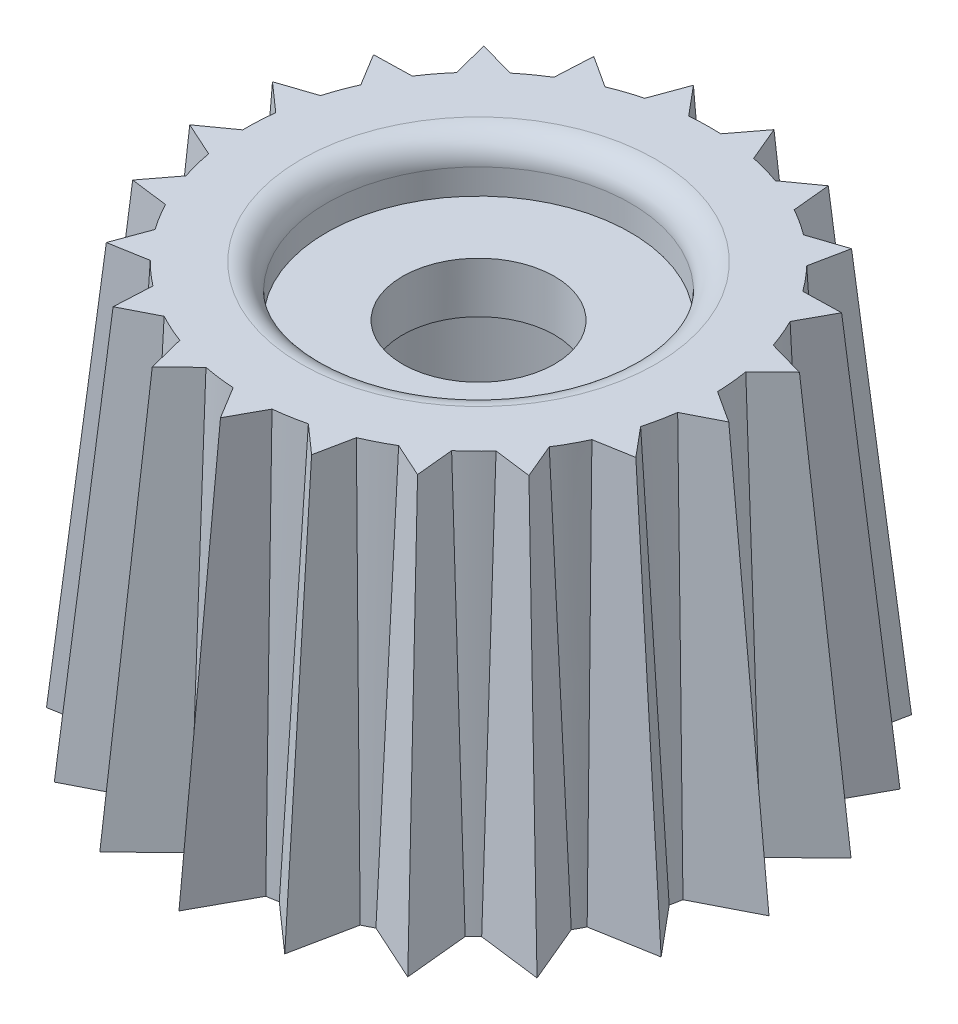
from build123d import *

# Parameters (mm, degrees)
BOSS_EXTRUDE1_DEPTH = 8
BOSS_EXTRUDE1_DRAFT = 3
SKETCH2_R           = 3
CUT_EXTRUDE1_DEPTH  = 6
SKETCH3_R           = 1.5
CUT_EXTRUDE2_DEPTH  = 6
FILLET3_R           = 0.5
CUT_EXTRUDE3_START  = -1
SKETCH4_R           = 3
CUT_EXTRUDE3_DEPTH  = 1
FILLET4_R           = 0.5


with BuildPart() as part:
    # Sketch1 → Boss-Extrude1 (with draft: the straight prism first)
    with BuildSketch(Plane(origin=(0, 0, 0), x_dir=(1, 0, 0), z_dir=(0, 1, 0))):
        with BuildLine():
            ThreePointArc((0, 5), (-0.115399429, 4.99866812), (-0.230737379, 4.994673189))
            Line((-0.230737379, 4.994673189), (-1.040018866, 5.962771522))
            Line((-1.040018866, 5.962771522), (-1.473775872, 4.777864029))
            ThreePointArc((-1.473775872, 4.777864029), (-1.58365585, 4.742576742), (-1.692692132, 4.704762837))
            Line((-1.692692132, 4.704762837), (-2.751371505, 5.391311371))
            Line((-2.751371505, 5.391311371), (-2.81660029, 4.131193872))
            ThreePointArc((-2.81660029, 4.131193872), (-2.911197498, 4.065086607), (-3.00424376, 3.99681366))
            Line((-3.00424376, 3.99681366), (-4.218252713, 4.340809546))
            Line((-4.218252713, 4.340809546), (-3.909157412, 3.117449009))
            ThreePointArc((-3.909157412, 3.117449009), (-3.980066474, 3.026395689), (-4.048855146, 2.93373005))
            Line((-4.048855146, 2.93373005), (-5.310323655, 2.904607743))
            Line((-5.310323655, 2.904607743), (-4.654368743, 1.826705122))
            ThreePointArc((-4.654368743, 1.826705122), (-4.695289077, 1.718796232), (-4.733707985, 1.60997165))
            Line((-4.733707985, 1.60997165), (-5.930549036, 1.210318796))
            Line((-5.930549036, 1.210318796), (-4.986018986, 0.373650468))
            ThreePointArc((-4.986018986, 0.373650468), (-4.99331464, 0.258474187), (-4.997950095, 0.143160204))
            Line((-4.997950095, 0.143160204), (-6.02381911, -0.591512288))
            Line((-6.02381911, -0.591512288), (-4.874639561, -1.11260467))
            ThreePointArc((-4.874639561, -1.11260467), (-4.847662285, -1.224814423), (-4.818102407, -1.336371654))
            Line((-4.818102407, -1.336371654), (-5.581846421, -2.340784909))
            Line((-5.581846421, -2.340784909), (-4.330127019, -2.5))
            ThreePointArc((-4.330127019, -2.5), (-4.271273862, -2.599272897), (-4.210145176, -2.697161026))
            Line((-4.210145176, -2.697161026), (-4.643902182, -3.882068519))
            Line((-4.643902182, -3.882068519), (-3.400863689, -3.665259359))
            ThreePointArc((-3.400863689, -3.665259359), (-3.315364013, -3.742774568), (-3.228098069, -3.818295805))
            Line((-3.228098069, -3.818295805), (-3.293326854, -5.078413304))
            Line((-3.293326854, -5.078413304), (-2.169418696, -4.50484434))
            ThreePointArc((-2.169418696, -4.50484434), (-2.064869521, -4.553714293), (-1.959220284, -4.600158245))
            Line((-1.959220284, -4.600158245), (-1.650124983, -5.823518782))
            Line((-1.650124983, -5.823518782), (-0.745211331, -4.944154131))
            ThreePointArc((-0.745211331, -4.944154131), (-0.630902312, -4.960036519), (-0.516257178, -4.973276438))
            Line((-0.516257178, -4.973276438), (0.139697734, -6.051179059))
            Line((0.139697734, -6.051179059), (0.745211331, -4.944154131))
            ThreePointArc((0.745211331, -4.944154131), (0.859123337, -4.925637734), (0.972577644, -4.904497194))
            Line((0.972577644, -4.904497194), (1.917107695, -5.741165522))
            Line((1.917107695, -5.741165522), (2.169418696, -4.50484434))
            ThreePointArc((2.169418696, -4.50484434), (2.272812107, -4.453574421), (2.374994674, -4.399931852))
            Line((2.374994674, -4.399931852), (3.524174223, -4.921024233))
            Line((3.524174223, -4.921024233), (3.400863689, -3.665259359))
            ThreePointArc((3.400863689, -3.665259359), (3.484551548, -3.585791476), (3.566383005, -3.504413255))
            Line((3.566383005, -3.504413255), (4.818102407, -3.663628346))
            Line((4.818102407, -3.663628346), (4.330127019, -2.5))
            ThreePointArc((4.330127019, -2.5), (4.386673291, -2.399395223), (4.440882555, -2.297512163))
            Line((4.440882555, -2.297512163), (5.683921048, -2.080703003))
            Line((5.683921048, -2.080703003), (4.874639561, -1.11260467))
            ThreePointArc((4.874639561, -1.11260467), (4.899019862, -0.999802174), (4.920790201, -0.886467032))
            Line((4.920790201, -0.886467032), (6.04469836, -0.312898067))
            Line((6.04469836, -0.312898067), (4.986018986, 0.373650468))
            ThreePointArc((4.986018986, 0.373650468), (4.97606702, 0.488627685), (4.963464044, 0.603344585))
            Line((4.963464044, 0.603344585), (5.868377696, 1.482709236))
            Line((5.868377696, 1.482709236), (4.654368743, 1.826705122))
            ThreePointArc((4.654368743, 1.826705122), (4.610968785, 1.933640831), (4.565112324, 2.039546388))
            Line((4.565112324, 2.039546388), (5.170625921, 3.146571316))
            Line((5.170625921, 3.146571316), (3.909157412, 3.117449009))
            ThreePointArc((3.909157412, 3.117449009), (3.836165739, 3.206841502), (3.761130341, 3.294525544))
            Line((3.761130341, 3.294525544), (4.013441342, 4.530846726))
            Line((4.013441342, 4.530846726), (2.81660029, 4.131193872))
            ThreePointArc((2.81660029, 4.131193872), (2.720502533, 4.195100234), (2.622955421, 4.256771647))
            Line((2.622955421, 4.256771647), (2.499644887, 5.512536521))
            Line((2.499644887, 5.512536521), (1.473775872, 4.777864029))
            ThreePointArc((1.473775872, 4.777864029), (1.363110737, 4.810605899), (1.251719402, 4.840784909))
            Line((1.251719402, 4.840784909), (0.763744014, 6.004413255))
            Line((0.763744014, 6.004413255), (0, 5))
        make_face()
    extrude(amount=BOSS_EXTRUDE1_DEPTH)
    # Boss-Extrude1: the draft: its side faces are tilted about the plane it starts from
    boss_extrude1_sides = [part.faces().sort_by_distance(p)[0] for p in [
        (4.867869122, 4, -2.593058852),
        (4.539891667, 4, -3.132010163),
        (3.836165739, 4, -3.206841502),
        (3.887285841, 4, -3.912686135),
        (3.415020816, 4, -4.331020299),
        (2.720502533, 4, -4.195100234),
        (2.561300154, 4, -4.884654084),
        (1.98671038, 4, -5.145200275),
        (1.363110737, 4, -4.810605899),
        (1.007731708, 4, -5.422599082),
        (0.381872007, 4, -5.502206628),
        (-0.115399429, 4, -4.99866812),
        (-0.635378122, 4, -5.478722355),
        (-1.256897369, 4, -5.370317775),
        (-1.58365585, 4, -4.742576742),
        (-2.222031818, 4, -5.048037104),
        (-2.783985898, 4, -4.761252621),
        (-2.911197498, 4, -4.065086607),
        (-3.611248236, 4, -4.168811603),
        (-4.063705062, 4, -3.729129278),
        (-3.980066474, 4, -3.026395689),
        (-4.679589401, 4, -2.919168896),
        (-4.982346199, 4, -2.365656432),
        (-4.695289077, 4, -1.718796232),
        (-5.332128511, 4, -1.410145223),
        (-5.458284011, 4, -0.791984632),
        (-4.99331464, 4, -0.258474187),
        (-5.510884603, 4, 0.224176042),
        (-5.449229336, 4, 0.852058479),
        (-4.847662285, 4, 1.224814423),
        (-5.199974414, 4, 1.838578282),
        (-4.95598672, 4, 2.420392455),
        (-4.271273862, 4, 2.599272897),
        (-4.427023679, 4, 3.289614773),
        (-4.022382935, 4, 3.773663939),
        (-3.315364013, 4, 3.742774568),
        (-3.260712462, 4, 4.448354555),
        (-2.731372775, 4, 4.791628822),
        (-2.064869521, 4, 4.553714293),
        (-1.804672633, 4, 5.211838513),
        (-1.197668157, 4, 5.383836456),
        (-0.630902312, 4, 4.960036519),
        (-0.188279722, 4, 5.512227748),
        (0.442454532, 4, 5.497666595),
        (0.859123337, 4, 4.925637734),
        (1.444842669, 4, 5.322831358),
        (2.043263195, 4, 5.123004931),
        (2.272812107, 4, 4.453574421),
        (2.949584449, 4, 4.660478042),
        (3.462518956, 4, 4.293141796),
        (3.484551548, 4, 3.585791476),
        (4.192242706, 4, 3.584020801),
        (4.574114713, 4, 3.081814173),
        (4.386673291, 4, 2.399395223),
        (5.062401801, 4, 2.189107583),
        (5.279280304, 4, 1.596653836),
        (4.899019862, 4, 0.999802174),
        (5.48274428, 4, 0.599682549),
        (5.515358673, 4, -0.030376201),
        (4.97606702, 4, -0.488627685),
        (5.41592087, 4, -1.043026911),
        (5.26137322, 4, -1.654707179),
        (4.610968785, 4, -1.933640831),
    ]]
    draft(boss_extrude1_sides, Plane(origin=(0, 0, 0), x_dir=(1, 0, 0), z_dir=(0, 1, 0)), BOSS_EXTRUDE1_DRAFT)

    # Sketch2 → Cut-Extrude1 (cut)
    with BuildSketch(Plane.XZ):
        with Locations(Location((0, 0, 0), (0, 0, 270))):
            Circle(SKETCH2_R)
    extrude(amount=-CUT_EXTRUDE1_DEPTH, mode=Mode.SUBTRACT)

    # Sketch3 → Cut-Extrude2 (cut)
    with BuildSketch(Plane.XZ.offset(-6)):
        with Locations(Location((0, 0, 0), (0, 0, 270))):
            Circle(SKETCH3_R)
    extrude(amount=-CUT_EXTRUDE2_DEPTH, mode=Mode.SUBTRACT)

    # Fillet3
    fillet3_edges = [part.edges().sort_by_distance(p)[0] for p in [
        (0, 6, 3),
    ]]
    fillet(fillet3_edges, radius=FILLET3_R)

    # Sketch4 → Cut-Extrude3 (cut)
    with BuildSketch(Plane(origin=(0, 8, 0), x_dir=(1, 0, 0), z_dir=(0, 1, 0)).offset(CUT_EXTRUDE3_START)):
        with Locations(Location((0, 0, 0), (0, 0, 90))):
            Circle(SKETCH4_R)
    extrude(amount=CUT_EXTRUDE3_DEPTH, mode=Mode.SUBTRACT)

    # Fillet4
    fillet4_edges = [part.edges().sort_by_distance(p)[0] for p in [
        (0, 8, 3),
    ]]
    fillet(fillet4_edges, radius=FILLET4_R)


solid = part.part
